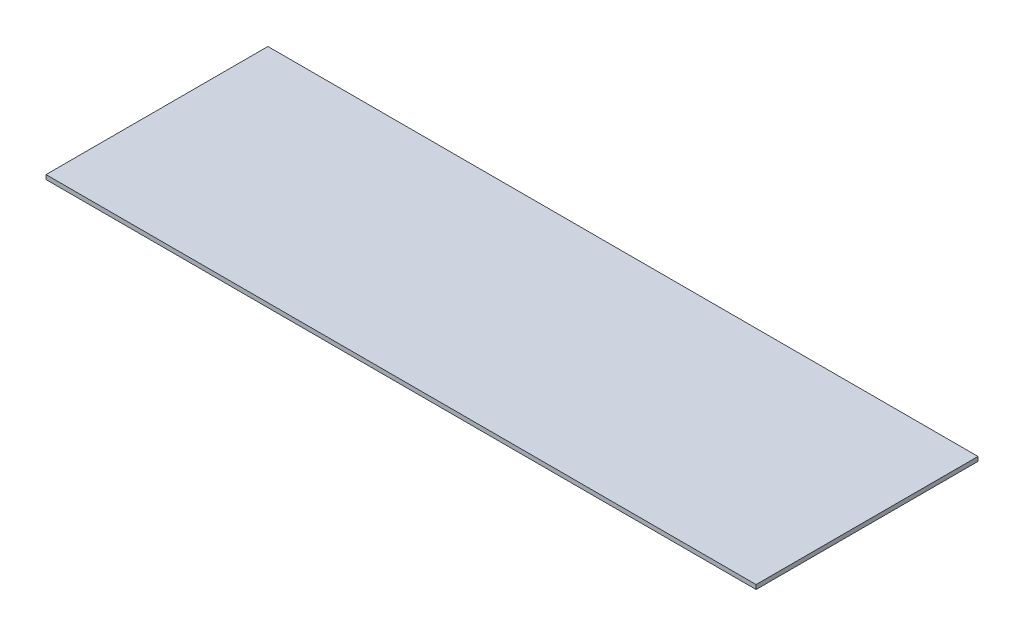
from build123d import *

# Parameters (mm, degrees)
SKETCH1_W           = 1044.448
SKETCH1_H           = 326.39
BOSS_EXTRUDE1_DEPTH = 6.35


with BuildPart() as part:
    # Sketch1 → Boss-Extrude1 (new body)
    with BuildSketch(Plane(origin=(0, 0, 0), x_dir=(1, 0, 0), z_dir=(0, 1, 0))):
        Rectangle(SKETCH1_W, SKETCH1_H)
    extrude(amount=BOSS_EXTRUDE1_DEPTH)


solid = part.part
